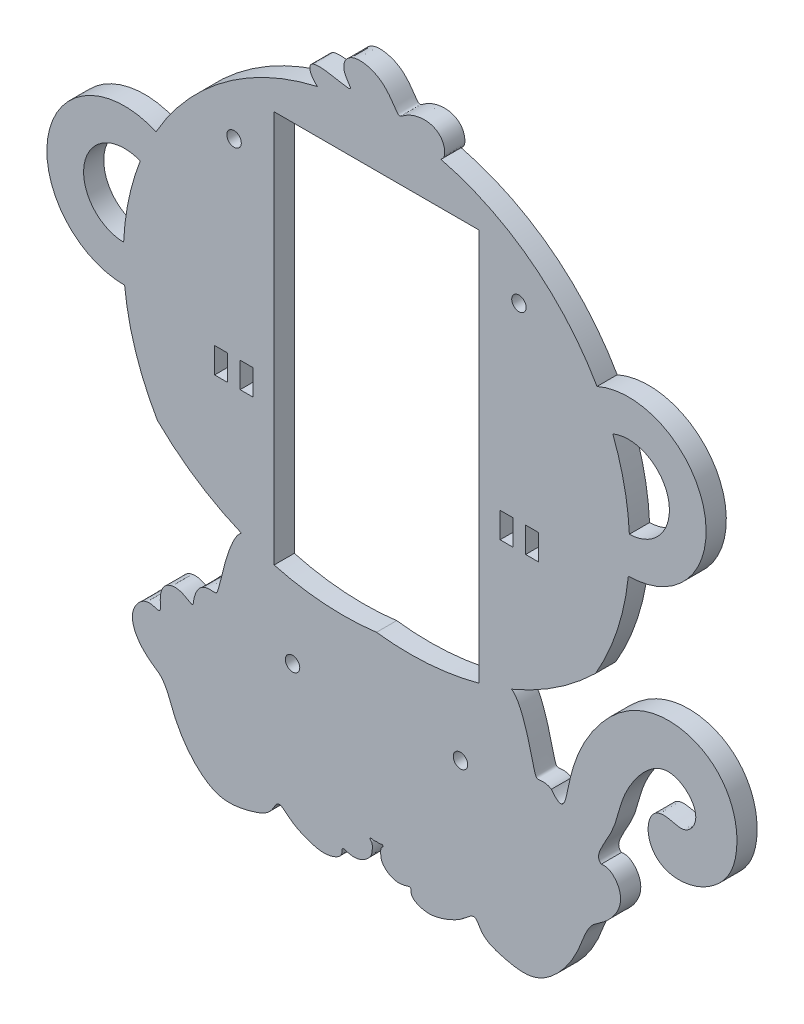
from build123d import *

# Parameters (mm, degrees)
MODEL_R             = 1.7
MODEL_W             = 3
MODEL_H             = 6
BOSS_EXTRUDE1_DEPTH = 4.75


with BuildPart() as part:
    # Model → Boss-Extrude1 (new body)
    with BuildSketch(Plane.XY):
        with BuildLine():
            add(Edge.make_bspline(
                [(-386.551251239, 396.327251189), (-386.916052394, 396.079204413), (-387.365984237, 395.634433922), (-387.896797281, 394.898644088), (-388.503330161, 393.757203334), (-389.171452603, 392.131003368), (-389.577925954, 391.014654975), (-389.970270784, 389.819275468), (-390.419319319, 388.323421516), (-390.83332726, 386.804935246), (-391.201587088, 385.34636593), (-391.516679205, 384.035346949), (-391.781698399, 382.944281063), (-391.975355466, 382.209449772), (-392.15403089, 381.664820315), (-392.336737386, 381.31109681), (-392.551498562, 381.129911234), (-392.833479669, 381.082225409), (-393.211479982, 381.115525432), (-393.693425125, 381.169472404), (-394.261194431, 381.182617586), (-394.881047474, 381.099420015), (-395.510435114, 380.877573231), (-396.105936728, 380.494485307), (-396.631517428, 379.95585235), (-397.063963964, 379.297531395), (-397.39210439, 378.573969962), (-397.617276013, 377.849585475), (-397.753517497, 377.188797135), (-397.82736951, 376.647023839), (-397.879059879, 376.260334721), (-397.959633552, 376.038465419), (-398.114782848, 375.972462073), (-398.366034123, 376.040823891), (-398.706936261, 376.21469148), (-399.120091801, 376.460086445), (-399.591458011, 376.741171495), (-400.117952431, 377.022315753), (-400.699774201, 377.268862798), (-401.463798734, 377.484035353), (-402.300244633, 377.553822048), (-403.174091852, 377.426716269), (-404.002173047, 377.065864722), (-404.698224792, 376.46441147), (-405.153470998, 375.811835942), (-405.461269956, 375.032169593), (-405.619922332, 374.166940367), (-405.657953521, 373.27889911), (-405.626485489, 372.442499072), (-405.587522811, 371.731075977), (-405.603727217, 371.205296174), (-405.727364814, 370.900755869), (-405.990085682, 370.81668236), (-406.39105056, 370.902146782), (-406.905602715, 371.07475403), (-407.496249881, 371.243305804), (-408.122207542, 371.327500075), (-408.751072773, 371.282728006), (-409.35960202, 371.097539496), (-409.931191749, 370.782809916), (-410.454421679, 370.36348433), (-410.921225043, 369.869653892), (-411.325051593, 369.32694511), (-411.659572418, 368.750331411), (-411.919102239, 368.147846593), (-412.098696202, 367.522400938), (-412.194371621, 366.874422897), (-412.203287138, 366.20397783), (-412.092164868, 365.237355517), (-411.795780763, 364.240492853), (-411.25356719, 363.0979097), (-410.505546493, 362.004000685), (-409.628552466, 361.020862692), (-408.940714048, 360.363039305), (-408.261699769, 359.795455705), (-407.719269628, 359.383631865), (-407.21381394, 359.028246689), (-406.753242924, 358.71792316), (-406.337217025, 358.432587935), (-405.958407604, 358.146100067), (-405.606436892, 357.832150323), (-405.270933307, 357.469037169), (-404.945150571, 357.045248498), (-404.628769556, 356.563710073), (-404.325203667, 356.036561227), (-404.039420225, 355.480831591), (-403.775511082, 354.913678765), (-403.486293011, 354.234906798), (-403.22438966, 353.563780813), (-402.971971356, 352.893055429), (-402.704512752, 352.203026621), (-402.401681187, 351.478012783), (-402.062584898, 350.721085445), (-401.674639208, 349.927966936), (-401.239024686, 349.111007443), (-400.763113802, 348.289788183), (-400.254340005, 347.481959495), (-399.722634495, 346.692998852), (-399.163365939, 345.932140679), (-398.574323946, 345.19923963), (-397.949478676, 344.488835597), (-397.28186749, 343.797089708), (-396.693729261, 343.232918759), (-395.94666487, 342.573889335), (-395.145878925, 341.947793479), (-394.290902186, 341.375211916), (-393.384167186, 340.882126765), (-392.430043668, 340.491703263), (-391.606002687, 340.243986907), (-390.756002743, 340.079446261), (-389.883129061, 339.998262902), (-388.990604918, 339.995014447), (-388.082210988, 340.060658996), (-387.162607569, 340.183979577), (-386.237707408, 340.353267946), (-385.315001235, 340.557855636), (-384.403963907, 340.789827334), (-383.516286063, 341.045384095), (-382.66652457, 341.327024633), (-381.871318875, 341.642937555), (-381.146754324, 342.002777686), (-380.506140062, 342.414272763), (-379.957720387, 342.879646699), (-379.50217975, 343.391768319), (-379.130782998, 343.931240964), (-378.821858803, 344.461005534), (-378.544703377, 344.932108886), (-378.267774642, 345.29593373), (-377.965518245, 345.51436395), (-377.625879138, 345.570992742), (-377.257148561, 345.481328236), (-376.875804119, 345.278776475), (-376.496250149, 345.00253689), (-376.11706805, 344.682307942), (-375.720845967, 344.335154988), (-375.283150649, 343.970625574), (-374.779103973, 343.593551859), (-374.190278948, 343.207542556), (-373.377688666, 342.741091189), (-372.449841911, 342.284943077), (-371.448923671, 341.861784637), (-370.434447105, 341.496921291), (-369.457107924, 341.211628122), (-368.685864943, 341.035221995), (-367.964373903, 340.924859402), (-367.285516994, 340.881136877), (-366.635919607, 340.902071878), (-366.001452121, 340.984188477), (-365.373937537, 341.123915256), (-364.75630659, 341.318535957), (-364.170945702, 341.568094094), (-363.657947564, 341.87428189), (-363.258368215, 342.235110671), (-362.999601239, 342.639822419), (-362.882834785, 343.065290294), (-362.862380856, 343.467877411), (-362.860328863, 343.794256059), (-362.800804618, 344.002021381), (-362.645316427, 344.082202864), (-362.403915174, 344.064482859), (-362.091030238, 343.983757423), (-361.712216892, 343.868949898), (-361.271123238, 343.746963048), (-360.772201451, 343.643387937), (-360.225145899, 343.584551667), (-359.643851104, 343.593953505), (-359.045609545, 343.68889199), (-358.331130904, 343.914571841), (-357.653031997, 344.271758954), (-357.055699253, 344.71601695), (-356.577458743, 345.17871164), (-356.233391408, 345.621031596), (-356.033125086, 345.975351534), (-355.902737419, 346.342883089), (-355.820827463, 346.757252518), (-355.769760706, 347.236551212), (-355.745106949, 347.759570584), (-355.762413964, 348.248781386), (-355.838587496, 348.623368474), (-355.977712536, 348.837568218), (-356.150848594, 348.941800594), (-356.292732028, 349.075710758), (-356.33646563, 349.288102762), (-356.236344626, 349.443149765), (-355.997125235, 349.455364951), (-355.677539018, 349.382302231), (-355.345578077, 349.318848286), (-355.1000792, 349.319880609), (-354.932396923, 349.356987082), (-354.827970147, 349.397996872), (-354.777593989, 349.422562594)],
                knots=[0, 0, 0, 0, 0, 0, 0.02, 0.025, 0.03, 0.035, 0.04, 0.045, 0.05, 0.06, 0.065, 0.07, 0.075, 0.08, 0.085, 0.09, 0.095, 0.1, 0.105, 0.11, 0.115, 0.12, 0.125, 0.13, 0.135, 0.14, 0.145, 0.15, 0.155, 0.16, 0.165, 0.17, 0.175, 0.18, 0.185, 0.19, 0.195, 0.2, 0.205, 0.21, 0.22, 0.225, 0.23, 0.235, 0.24, 0.245, 0.25, 0.255, 0.26, 0.265, 0.27, 0.275, 0.28, 0.285, 0.29, 0.295, 0.3, 0.305, 0.31, 0.315, 0.32, 0.325, 0.33, 0.335, 0.34, 0.345, 0.35, 0.355, 0.36, 0.375, 0.38, 0.39, 0.395, 0.4, 0.405, 0.41, 0.415, 0.42, 0.425, 0.43, 0.435, 0.44, 0.445, 0.45, 0.455, 0.46, 0.465, 0.47, 0.48, 0.485, 0.49, 0.495, 0.5, 0.51, 0.515, 0.52, 0.525, 0.53, 0.54, 0.545, 0.55, 0.555, 0.56, 0.565, 0.575, 0.58, 0.585, 0.59, 0.595, 0.6, 0.605, 0.61, 0.615, 0.62, 0.625, 0.63, 0.635, 0.64, 0.645, 0.65, 0.655, 0.66, 0.665, 0.67, 0.675, 0.68, 0.685, 0.69, 0.695, 0.7, 0.705, 0.71, 0.715, 0.72, 0.725, 0.73, 0.735, 0.74, 0.745, 0.755, 0.76, 0.765, 0.77, 0.775, 0.78, 0.785, 0.79, 0.795, 0.8, 0.805, 0.81, 0.815, 0.82, 0.825, 0.83, 0.835, 0.84, 0.845, 0.85, 0.855, 0.86, 0.865, 0.87, 0.875, 0.88, 0.885, 0.89, 0.895, 0.905, 0.91, 0.915, 0.92, 0.925, 0.93, 0.935, 0.94, 0.945, 0.95, 0.955, 0.96, 0.965, 0.97, 0.975, 0.98, 0.985, 0.99, 0.995, 1, 1, 1, 1, 1, 1], degree=5))
            add(Edge.make_bspline(
                [(-301.898947089, 371.249991702), (-301.80670497, 371.265018138), (-301.589974955, 371.293910279), (-301.244905456, 371.313674079), (-300.773941346, 371.273545454), (-300.195585957, 371.097539496), (-299.623996228, 370.782809916), (-299.100766299, 370.36348433), (-298.633962934, 369.869653892), (-298.230136384, 369.32694511), (-297.89561556, 368.750331411), (-297.636085738, 368.147846593), (-297.456491776, 367.522400938), (-297.360816357, 366.874422897), (-297.35190084, 366.20397783), (-297.463023109, 365.237355517), (-297.759407215, 364.240492853), (-298.301620787, 363.0979097), (-299.049641484, 362.004000685), (-299.926635511, 361.020862692), (-300.61447393, 360.363039305), (-301.293488209, 359.795455705), (-301.83591835, 359.383631865), (-302.341374037, 359.028246689), (-302.801945054, 358.71792316), (-303.217970952, 358.432587935), (-303.596780374, 358.146100067), (-303.948751085, 357.832150323), (-304.28425467, 357.469037169), (-304.610037406, 357.045248498), (-304.926418421, 356.563710073), (-305.22998431, 356.036561227), (-305.515767753, 355.480831591), (-305.779676896, 354.913678765), (-306.068894967, 354.234906798), (-306.330798317, 353.563780813), (-306.583216622, 352.893055429), (-306.850675225, 352.203026621), (-307.15350679, 351.478012783), (-307.492603079, 350.721085445), (-307.88054877, 349.927966936), (-308.316163291, 349.111007443), (-308.792074176, 348.289788183), (-309.300847972, 347.481959495), (-309.832553482, 346.692998852), (-310.391822039, 345.932140679), (-310.980864031, 345.19923963), (-311.605709301, 344.488835597), (-312.273320488, 343.797089708), (-312.861458716, 343.232918759), (-313.608523108, 342.573889335), (-314.409309053, 341.947793479), (-315.264285791, 341.375211916), (-316.171020791, 340.882126765), (-317.125144309, 340.491703263), (-317.949185291, 340.243986907), (-318.799185234, 340.079446261), (-319.672058916, 339.998262902), (-320.564583059, 339.995014447), (-321.472976989, 340.060658996), (-322.392580408, 340.183979577), (-323.31748057, 340.353267946), (-324.240186742, 340.557855636), (-325.151224071, 340.789827334), (-326.038901914, 341.045384095), (-326.888663407, 341.327024633), (-327.683869103, 341.642937555), (-328.408433654, 342.002777686), (-329.049047915, 342.414272763), (-329.59746759, 342.879646699), (-330.053008227, 343.391768319), (-330.42440498, 343.931240964), (-330.733329174, 344.461005534), (-331.0104846, 344.932108886), (-331.287413335, 345.29593373), (-331.589669732, 345.51436395), (-331.929308839, 345.570992742), (-332.298039416, 345.481328236), (-332.679383858, 345.278776475), (-333.058937829, 345.00253689), (-333.438119927, 344.682307942), (-333.83434201, 344.335154988), (-334.272037329, 343.970625574), (-334.776084004, 343.593551859), (-335.364909029, 343.207542556), (-336.177499311, 342.741091189), (-337.105346067, 342.284943077), (-338.106264306, 341.861784637), (-339.120740873, 341.496921291), (-340.098080053, 341.211628122), (-340.869323035, 341.035221995), (-341.590814074, 340.924859402), (-342.269670984, 340.881136877), (-342.91926837, 340.902071878), (-343.553735856, 340.984188477), (-344.18125044, 341.123915256), (-344.798881387, 341.318535957), (-345.384242276, 341.568094094), (-345.897240413, 341.87428189), (-346.296819762, 342.235110671), (-346.555586738, 342.639822419), (-346.672353193, 343.065290294), (-346.692807122, 343.467877411), (-346.694859114, 343.794256059), (-346.754383359, 344.002021381), (-346.909871551, 344.082202864), (-347.151272803, 344.064482859), (-347.46415774, 343.983757423), (-347.842971085, 343.868949898), (-348.284064739, 343.746963048), (-348.782986526, 343.643387937), (-349.330042079, 343.584551667), (-349.911336873, 343.593953505), (-350.509578433, 343.68889199), (-351.224057074, 343.914571841), (-351.902155981, 344.271758954), (-352.499488725, 344.71601695), (-352.977729235, 345.17871164), (-353.321796569, 345.621031596), (-353.522062892, 345.975351534), (-353.652450559, 346.342883089), (-353.734360514, 346.757252518), (-353.785427271, 347.236551212), (-353.810081029, 347.759570584), (-353.792774013, 348.248781386), (-353.716600481, 348.623368474), (-353.577475441, 348.837568218), (-353.404339383, 348.941800594), (-353.262455949, 349.075710758), (-353.218722348, 349.288102762), (-353.318843352, 349.443149765), (-353.558062742, 349.455364951), (-353.87764896, 349.382302231), (-354.2096099, 349.318848286), (-354.455108777, 349.319880609), (-354.622791055, 349.356987082), (-354.727217831, 349.397996872), (-354.777593989, 349.422562594)],
                knots=[0.291239622, 0.291239622, 0.291239622, 0.291239622, 0.291239622, 0.291239622, 0.295, 0.3, 0.305, 0.31, 0.315, 0.32, 0.325, 0.33, 0.335, 0.34, 0.345, 0.35, 0.355, 0.36, 0.375, 0.38, 0.39, 0.395, 0.4, 0.405, 0.41, 0.415, 0.42, 0.425, 0.43, 0.435, 0.44, 0.445, 0.45, 0.455, 0.46, 0.465, 0.47, 0.48, 0.485, 0.49, 0.495, 0.5, 0.51, 0.515, 0.52, 0.525, 0.53, 0.54, 0.545, 0.55, 0.555, 0.56, 0.565, 0.575, 0.58, 0.585, 0.59, 0.595, 0.6, 0.605, 0.61, 0.615, 0.62, 0.625, 0.63, 0.635, 0.64, 0.645, 0.65, 0.655, 0.66, 0.665, 0.67, 0.675, 0.68, 0.685, 0.69, 0.695, 0.7, 0.705, 0.71, 0.715, 0.72, 0.725, 0.73, 0.735, 0.74, 0.745, 0.755, 0.76, 0.765, 0.77, 0.775, 0.78, 0.785, 0.79, 0.795, 0.8, 0.805, 0.81, 0.815, 0.82, 0.825, 0.83, 0.835, 0.84, 0.845, 0.85, 0.855, 0.86, 0.865, 0.87, 0.875, 0.88, 0.885, 0.89, 0.895, 0.905, 0.91, 0.915, 0.92, 0.925, 0.93, 0.935, 0.94, 0.945, 0.95, 0.955, 0.96, 0.965, 0.97, 0.975, 0.98, 0.985, 0.99, 0.995, 1, 1, 1, 1, 1, 1], degree=5))
            add(Edge.make_bspline(
                [(-301.898947089, 371.249991702), (-302.03777992, 371.337842664), (-302.278358106, 371.535036125), (-302.527935786, 371.895313524), (-302.638326758, 372.504569396), (-302.422921716, 373.473093417), (-301.910810817, 374.622658725), (-301.203239072, 375.907021068), (-300.417430607, 377.272852531), (-299.663776374, 378.670412259), (-299.023340821, 380.063869225), (-298.518808306, 381.445147803), (-298.11469187, 382.832378816), (-297.742815902, 384.255163919), (-297.321372994, 385.743083541), (-296.774951218, 387.313965856), (-296.05819531, 388.959584105), (-295.162040147, 390.642897503), (-294.101045993, 392.307630147), (-292.906052001, 393.884476201), (-291.614267711, 395.298727975), (-290.261394711, 396.477163759), (-288.870633099, 397.355559995), (-287.450506474, 397.88487723), (-286.008600232, 398.034757091), (-284.562929688, 397.798008073), (-283.152043236, 397.193839546), (-281.851079655, 396.27377504), (-280.76403377, 395.118025382), (-279.993445178, 393.822748232), (-279.614594112, 392.489509944), (-279.651481692, 391.214486489), (-280.042701572, 390.076155472), (-280.672983329, 389.134306182), (-281.424791372, 388.432592409), (-282.224227316, 388.000042889), (-283.086509475, 387.852497186), (-284.061898655, 387.966698541), (-285.187617596, 388.257647228), (-286.432799241, 388.549506411), (-287.714778317, 388.627521421), (-288.922339625, 388.299673225), (-289.935960884, 387.451354667), (-290.650627543, 386.112012698), (-290.983205819, 384.420926362), (-290.877596402, 382.578851159), (-290.311010342, 380.803687119), (-289.299028152, 379.286710653), (-287.903220924, 378.142688713), (-286.219105708, 377.4170411), (-284.360670175, 377.103581142), (-282.445893609, 377.158636255), (-280.582328457, 377.516407907), (-278.851525965, 378.104383008), (-277.297305988, 378.856918007), (-275.93548394, 379.717384281), (-274.760882323, 380.641693853), (-273.755463023, 381.601444913), (-272.895776168, 382.586894991), (-272.161214125, 383.610945588), (-271.535866394, 384.70099922), (-271.009722971, 385.888830428), (-270.579877607, 387.201933377), (-270.252293644, 388.652401735), (-270.040978563, 390.2346489), (-269.965016257, 391.930118455), (-270.046205794, 393.710009769), (-270.306480744, 395.538773505), (-270.857132325, 397.745077765), (-271.727774145, 399.906931327), (-272.937052277, 401.94602382), (-274.485083983, 403.787796033), (-276.348901152, 405.366769995), (-278.092782759, 406.4785487), (-280.379149882, 407.539092006), (-283.265109328, 408.344541641), (-286.299006859, 408.594090842), (-289.32996603, 408.269637229), (-292.650761978, 407.269272218), (-295.374305071, 405.888080142), (-297.55376872, 404.384775694), (-299.570759796, 402.614165823), (-301.423227661, 400.629872898), (-302.855961089, 398.859622636), (-304.437971019, 396.623488316), (-305.836320205, 394.276384281), (-307.030109551, 391.853114628), (-308.001652746, 389.39378453), (-308.755268533, 386.963327702), (-309.250925564, 385.001542652), (-309.640561499, 383.162221439), (-309.968617434, 381.523898785), (-310.292721218, 380.178229359), (-310.673366326, 379.216827317), (-311.16584039, 378.72093299), (-311.809926861, 378.748147162), (-312.461695262, 379.21039337), (-313.030249288, 379.809050666), (-313.444699739, 380.320105618), (-313.6607794, 380.60362174)],
                knots=[0.011105874, 0.011105874, 0.011105874, 0.011105874, 0.011105874, 0.011105874, 0.021105874, 0.031105874, 0.041105874, 0.051105874, 0.061105874, 0.071105874, 0.081105874, 0.091105874, 0.101105874, 0.111105874, 0.121105874, 0.131105874, 0.141105874, 0.151105874, 0.161105874, 0.171105874, 0.181105874, 0.191105874, 0.201105874, 0.211105874, 0.221105874, 0.231105874, 0.241105874, 0.251105874, 0.261105874, 0.271105874, 0.281105874, 0.291105874, 0.301105874, 0.311105874, 0.321105874, 0.331105874, 0.341105874, 0.351105874, 0.361105874, 0.371105874, 0.381105874, 0.391105874, 0.401105874, 0.411105874, 0.421105874, 0.431105874, 0.441105874, 0.451105874, 0.461105874, 0.471105874, 0.481105874, 0.491105874, 0.501105874, 0.511105874, 0.521105874, 0.531105874, 0.541105874, 0.551105874, 0.561105874, 0.571105874, 0.581105874, 0.591105874, 0.601105874, 0.611105874, 0.621105874, 0.631105874, 0.641105874, 0.651105874, 0.661105874, 0.671105874, 0.681105874, 0.701105874, 0.711105874, 0.721105874, 0.731105874, 0.741105874, 0.751105874, 0.771105874, 0.791105874, 0.801105874, 0.811105874, 0.831105874, 0.841105874, 0.851105874, 0.861105874, 0.871105874, 0.881105874, 0.901105874, 0.911105874, 0.921105874, 0.931105874, 0.941105874, 0.951105874, 0.961105874, 0.971105874, 0.981105874, 0.991105874, 1.001105874, 1.011105874, 1.011105874, 1.011105874, 1.011105874, 1.011105874, 1.011105874], degree=5))
            add(Edge.make_bspline(
                [(-323.003936738, 396.327251189), (-322.639135583, 396.079204413), (-322.18920374, 395.634433922), (-321.658390696, 394.898644088), (-321.051857816, 393.757203334), (-320.383735374, 392.131003368), (-319.977262023, 391.014654975), (-319.584917193, 389.819275468), (-319.135868658, 388.323421516), (-318.721860717, 386.804935246), (-318.353600889, 385.34636593), (-318.038508773, 384.035346949), (-317.773489578, 382.944281063), (-317.579832511, 382.209449772), (-317.401157087, 381.664820315), (-317.218450591, 381.31109681), (-317.003689416, 381.129911234), (-316.721708308, 381.082225409), (-316.343707995, 381.115525432), (-315.861762853, 381.169472404), (-315.293993546, 381.182617586), (-314.716438841, 381.105097359), (-314.256472836, 380.951412883), (-313.932453608, 380.783648044), (-313.737120758, 380.657216991), (-313.6607794, 380.60362174)],
                knots=[0, 0, 0, 0, 0, 0, 0.02, 0.025, 0.03, 0.035, 0.04, 0.045, 0.05, 0.06, 0.065, 0.07, 0.075, 0.08, 0.085, 0.09, 0.095, 0.1, 0.105, 0.11, 0.115, 0.12, 0.123294018, 0.123294018, 0.123294018, 0.123294018, 0.123294018, 0.123294018], degree=5))
            ThreePointArc((-323.003936738, 396.327251189), (-312.498766528, 401.927835806), (-303.24831057, 409.421447336))
            ThreePointArc((-303.24831057, 409.421447336), (-298.124131535, 420.844790734), (-295.53920269, 433.095020448))
            ThreePointArc((-295.53920269, 433.095020448), (-277.643269068, 455.12113969), (-302.913653982, 468.037099404))
            ThreePointArc((-302.913653982, 468.037099404), (-318.490243046, 485.80537303), (-339.811140885, 495.991686882))
            add(Edge.make_bspline(
                [(-368.648535438, 496.252173352), (-368.744458236, 496.318852064), (-368.933155722, 496.46135137), (-369.206763211, 496.702529524), (-369.552638711, 497.078952875), (-369.945448044, 497.635151945), (-370.27396009, 498.258937778), (-370.49029081, 498.914952019), (-370.51070775, 499.541563445), (-370.238365938, 500.064302422), (-369.5990972, 500.417471707), (-368.57162488, 500.562380095), (-367.22355688, 500.508813977), (-365.687080465, 500.304348965), (-364.130399482, 500.021394498), (-362.730437113, 499.744991582), (-361.645780778, 499.560560003), (-360.987783845, 499.541133492), (-360.796409046, 499.736067669), (-361.003653893, 500.155847055), (-361.456239643, 500.775355547), (-361.969645158, 501.546412025), (-362.368346783, 502.406968262), (-362.540769792, 503.292531993), (-362.454363932, 504.143316727), (-362.127001431, 504.906996063), (-361.609010526, 505.54285956), (-360.962354705, 506.024792223), (-360.237689537, 506.346315269), (-359.465109655, 506.519028644), (-358.662050204, 506.563781119), (-357.836770513, 506.503364206), (-356.993360104, 506.355416269), (-356.136711355, 506.123246396), (-355.27524615, 505.794703449), (-354.419874931, 505.352916652), (-353.583850229, 504.783872945), (-352.782377599, 504.085819177), (-352.032065864, 503.276653785), (-351.351103862, 502.405268117), (-350.756796891, 501.550400765), (-350.259062752, 500.800910062), (-349.854900796, 500.240489256), (-349.52240587, 499.930593307), (-349.215031159, 499.894076524), (-348.855526802, 500.098537748), (-348.362085472, 500.475509867), (-347.67170771, 500.938251599), (-346.770031422, 501.402187782), (-345.688786994, 501.792289415), (-344.48987856, 502.045099565), (-343.253856136, 502.112491058), (-342.066559862, 501.964757688), (-341.006667622, 501.593968073), (-340.132609258, 501.01739116), (-339.470394525, 500.280534755), (-339.021946768, 499.447136213), (-338.772548612, 498.589873373), (-338.698846344, 497.780410896), (-338.775989921, 497.080683391), (-338.986639614, 496.531262609), (-339.255348506, 496.227388525), (-339.511863577, 496.0787419), (-339.707309513, 496.014838841), (-339.811140885, 495.991686882)],
                knots=[0, 0, 0, 0, 0, 0, 0.016666667, 0.033333333, 0.05, 0.066666667, 0.083333333, 0.1, 0.116666667, 0.133333333, 0.15, 0.166666667, 0.183333333, 0.2, 0.216666667, 0.233333333, 0.25, 0.266666667, 0.283333333, 0.3, 0.316666667, 0.333333333, 0.35, 0.366666667, 0.383333333, 0.4, 0.416666667, 0.433333333, 0.45, 0.466666667, 0.483333333, 0.5, 0.516666667, 0.533333333, 0.55, 0.566666667, 0.583333333, 0.6, 0.616666667, 0.633333333, 0.65, 0.666666667, 0.683333333, 0.7, 0.716666667, 0.733333333, 0.75, 0.766666667, 0.783333333, 0.8, 0.816666667, 0.833333333, 0.85, 0.866666667, 0.883333333, 0.9, 0.916666667, 0.933333333, 0.95, 0.966666667, 0.983333333, 1, 1, 1, 1, 1, 1], degree=5))
            ThreePointArc((-368.648535438, 496.252173352), (-390.614540969, 486.143224047), (-406.641533995, 468.037099404))
            ThreePointArc((-406.641533995, 468.037099404), (-431.911918909, 455.12113969), (-414.015985287, 433.095020448))
            ThreePointArc((-414.015985287, 433.095020448), (-411.431056442, 420.844790734), (-406.306877408, 409.421447336))
            ThreePointArc((-406.306877408, 409.421447336), (-397.05642145, 401.927835806), (-386.551251239, 396.327251189))
        make_face()
        with BuildLine():
            ThreePointArc((-354.777593989, 392.029236712), (-366.896657765, 391.689024277), (-378.852790249, 393.698588241))
            Line((-378.852790249, 393.698588241), (-378.852790249, 486.018531516))
            Line((-378.852790249, 486.018531516), (-330.702397729, 486.018531516))
            Line((-330.702397729, 486.018531516), (-330.702397729, 393.698588241))
            ThreePointArc((-330.702397729, 393.698588241), (-342.658530213, 391.689024277), (-354.777593989, 392.029236712))
        make_face(mode=Mode.SUBTRACT)
        with Locations((-374.527593989, 375.779236712)):
            Circle(MODEL_R, mode=Mode.SUBTRACT)
        with Locations((-335.027593989, 375.779236712)):
            Circle(MODEL_R, mode=Mode.SUBTRACT)
        with Locations((-321.277593989, 475.779236712)):
            Circle(MODEL_R, mode=Mode.SUBTRACT)
        with Locations((-388.277593989, 475.779236712)):
            Circle(MODEL_R, mode=Mode.SUBTRACT)
        with Locations((-318.202397729, 428.411604313)):
            Rectangle(MODEL_W, MODEL_H, mode=Mode.SUBTRACT)
        with Locations((-324.202397729, 428.411604313)):
            Rectangle(MODEL_W, MODEL_H, mode=Mode.SUBTRACT)
        with Locations((-385.352790249, 428.411604313)):
            Rectangle(MODEL_W, MODEL_H, mode=Mode.SUBTRACT)
        with Locations((-391.352790249, 428.411604313)):
            Rectangle(MODEL_W, MODEL_H, mode=Mode.SUBTRACT)
        with BuildLine():
            ThreePointArc((-414.252942121, 441.734311673), (-423.460915188, 453.337573366), (-410.349392029, 460.23035295))
            ThreePointArc((-410.349392029, 460.23035295), (-413.050642353, 451.140507471), (-414.252942121, 441.734311673))
        make_face(mode=Mode.SUBTRACT)
        with BuildLine():
            ThreePointArc((-295.302245857, 441.734311673), (-296.504545624, 451.140507471), (-299.205795948, 460.23035295))
            ThreePointArc((-299.205795948, 460.23035295), (-286.094272789, 453.337573366), (-295.302245857, 441.734311673))
        make_face(mode=Mode.SUBTRACT)
    extrude(amount=BOSS_EXTRUDE1_DEPTH)


solid = part.part
